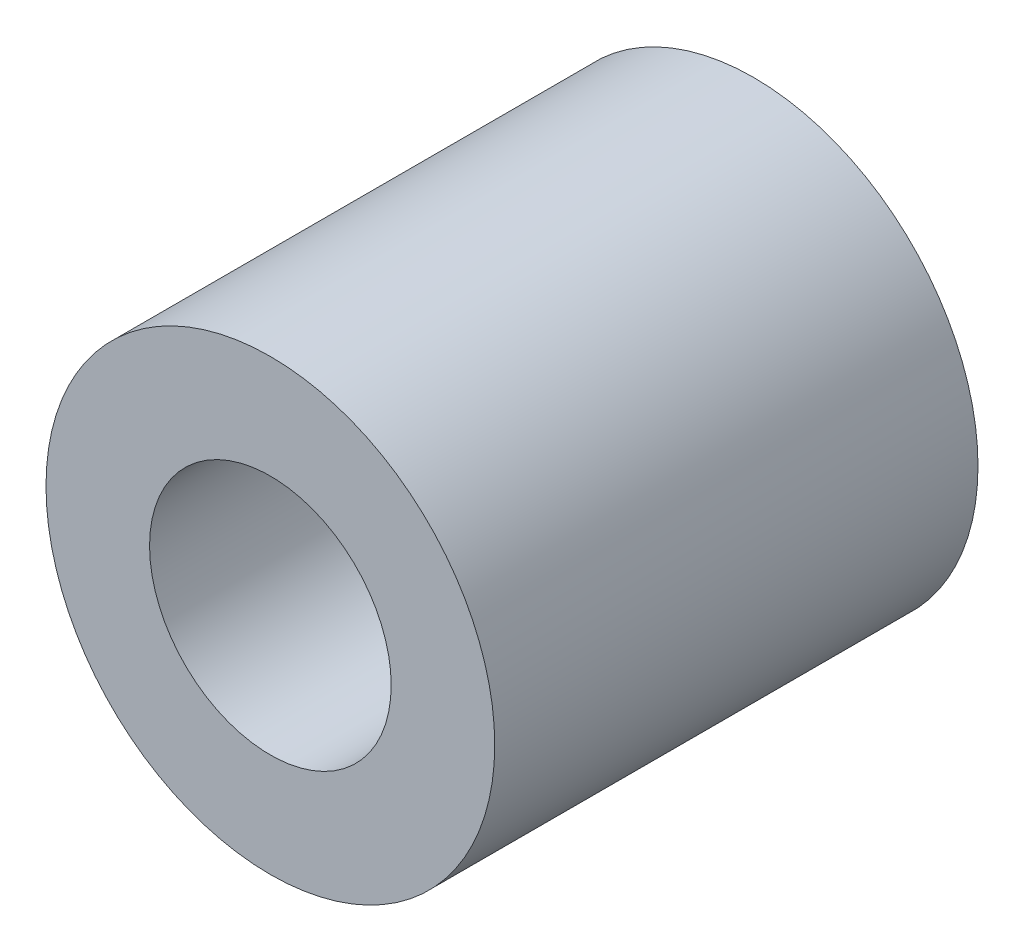
from build123d import *

# Parameters (mm, degrees)
ESBO_O1_R                = 3.25
RESSALTO_EXTRUS_O1_DEPTH = 7
ESBO_O2_R                = 1.75
CORTE_EXTRUS_O1_DEPTH    = 7


with BuildPart() as part:
    # Esboço1 → Ressalto-extrusão1 (new body)
    with BuildSketch(Plane.XY):
        Circle(ESBO_O1_R)
    extrude(amount=RESSALTO_EXTRUS_O1_DEPTH)

    # Esboço2 → Corte-extrusão1 (cut)
    with BuildSketch(Plane(origin=(0, 0, 0), x_dir=(-1, 0, 0), z_dir=(0, 0, -1))):
        Circle(ESBO_O2_R)
    extrude(amount=-CORTE_EXTRUS_O1_DEPTH, mode=Mode.SUBTRACT)


solid = part.part
